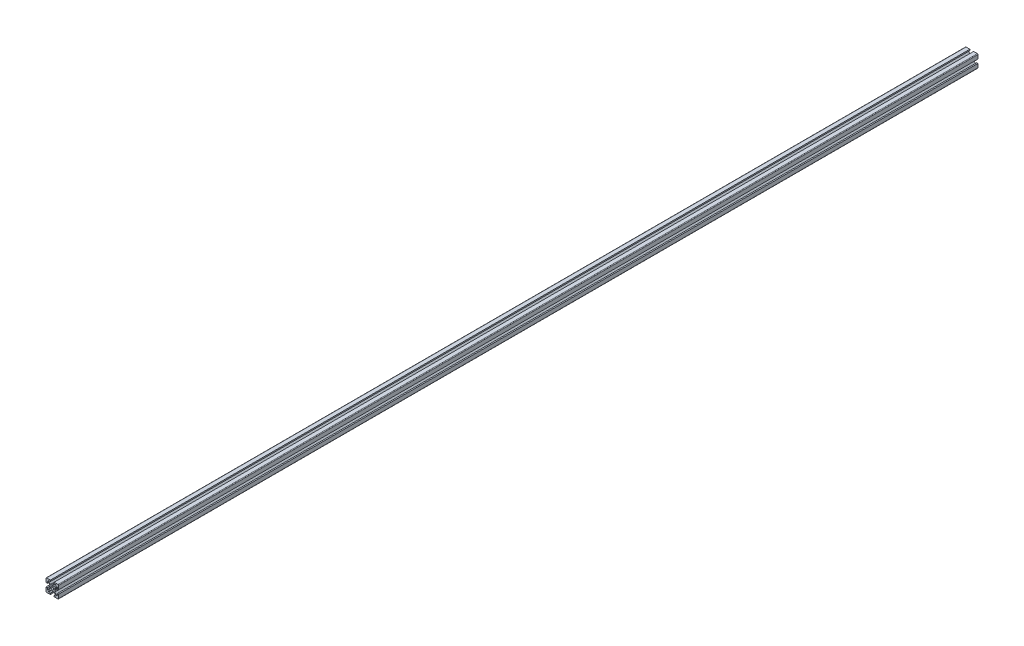
from build123d import *

# Parameters (mm, degrees)
SKETCH_1_R      = 2.1
EXTRUDE_1_DEPTH = 1460


with BuildPart() as part:
    # 草圖1 → 填料-伸長1 (new body)
    with BuildSketch(Plane(origin=(0, 0, -2500), x_dir=(-1, 0, 0), z_dir=(0, 0, -1))):
        with BuildLine():
            Line((10, -3), (8, -3))
            Line((8, -3), (8, -6))
            Line((8, -6), (7.060660172, -6))
            Line((7.060660172, -6), (4, -2.939339828))
            Line((4, -2.939339828), (4, -2.5))
            Line((4, -2.5), (3.750976592, -1.218885629))
            Line((3.750976592, -1.218885629), (3.933012702, -0.903589838))
            ThreePointArc((3.933012702, -0.903589838), (4, -0.653589838), (3.933012702, -0.403589838))
            Line((3.933012702, -0.403589838), (3.7, 0))
            Line((3.7, 0), (3.933012702, 0.403589838))
            ThreePointArc((3.933012702, 0.403589838), (3.982962913, 0.524180316), (4, 0.653589838))
            Line((4, 0.653589838), (4, 2.939339828))
            Line((4, 2.939339828), (7.060660172, 6))
            Line((7.060660172, 6), (8, 6))
            Line((8, 6), (8, 3))
            Line((8, 3), (10, 3))
            Line((10, 3), (10, 9))
            ThreePointArc((10, 9), (9.707106781, 9.707106781), (9, 10))
            Line((9, 10), (3, 10))
            Line((3, 10), (3, 8))
            Line((3, 8), (6, 8))
            Line((6, 8), (6, 7.060660172))
            Line((6, 7.060660172), (2.939339828, 4))
            Line((2.939339828, 4), (2.5, 4))
            Line((2.5, 4), (1.218885629, 3.750976592))
            Line((1.218885629, 3.750976592), (0.903589838, 3.933012702))
            ThreePointArc((0.903589838, 3.933012702), (0.653589838, 4), (0.403589838, 3.933012702))
            Line((0.403589838, 3.933012702), (0, 3.7))
            Line((0, 3.7), (-0.403589838, 3.933012702))
            ThreePointArc((-0.403589838, 3.933012702), (-0.524180316, 3.982962913), (-0.653589838, 4))
            Line((-0.653589838, 4), (-2.939339828, 4))
            Line((-2.939339828, 4), (-6, 7.060660172))
            Line((-6, 7.060660172), (-6, 8))
            Line((-6, 8), (-3, 8))
            Line((-3, 8), (-3, 10))
            Line((-3, 10), (-9, 10))
            ThreePointArc((-9, 10), (-9.707106781, 9.707106781), (-10, 9))
            Line((-10, 9), (-10, 3))
            Line((-10, 3), (-8, 3))
            Line((-8, 3), (-8, 6))
            Line((-8, 6), (-7.060660172, 6))
            Line((-7.060660172, 6), (-4, 2.939339828))
            Line((-4, 2.939339828), (-4, 2.5))
            Line((-4, 2.5), (-3.750976592, 1.218885629))
            Line((-3.750976592, 1.218885629), (-3.933012702, 0.903589838))
            ThreePointArc((-3.933012702, 0.903589838), (-4, 0.653589838), (-3.933012702, 0.403589838))
            Line((-3.933012702, 0.403589838), (-3.7, 0))
            Line((-3.7, 0), (-3.933012702, -0.403589838))
            ThreePointArc((-3.933012702, -0.403589838), (-3.982962913, -0.524180316), (-4, -0.653589838))
            Line((-4, -0.653589838), (-4, -2.939339828))
            Line((-4, -2.939339828), (-7.060660172, -6))
            Line((-7.060660172, -6), (-8, -6))
            Line((-8, -6), (-8, -3))
            Line((-8, -3), (-10, -3))
            Line((-10, -3), (-10, -9))
            ThreePointArc((-10, -9), (-9.707106781, -9.707106781), (-9, -10))
            Line((-9, -10), (-3, -10))
            Line((-3, -10), (-3, -8))
            Line((-3, -8), (-6, -8))
            Line((-6, -8), (-6, -7.060660172))
            Line((-6, -7.060660172), (-2.939339828, -4))
            Line((-2.939339828, -4), (-2.5, -4))
            Line((-2.5, -4), (-1.218885629, -3.750976592))
            Line((-1.218885629, -3.750976592), (-0.903589838, -3.933012702))
            ThreePointArc((-0.903589838, -3.933012702), (-0.653589838, -4), (-0.403589838, -3.933012702))
            Line((-0.403589838, -3.933012702), (0, -3.7))
            Line((0, -3.7), (0.403589838, -3.933012702))
            ThreePointArc((0.403589838, -3.933012702), (0.524180316, -3.982962913), (0.653589838, -4))
            Line((0.653589838, -4), (2.939339828, -4))
            Line((2.939339828, -4), (6, -7.060660172))
            Line((6, -7.060660172), (6, -8))
            Line((6, -8), (3, -8))
            Line((3, -8), (3, -10))
            Line((3, -10), (9, -10))
            ThreePointArc((9, -10), (9.707106781, -9.707106781), (10, -9))
            Line((10, -9), (10, -3))
        make_face()
        Circle(SKETCH_1_R, mode=Mode.SUBTRACT)
    extrude(amount=-EXTRUDE_1_DEPTH)


solid = part.part
